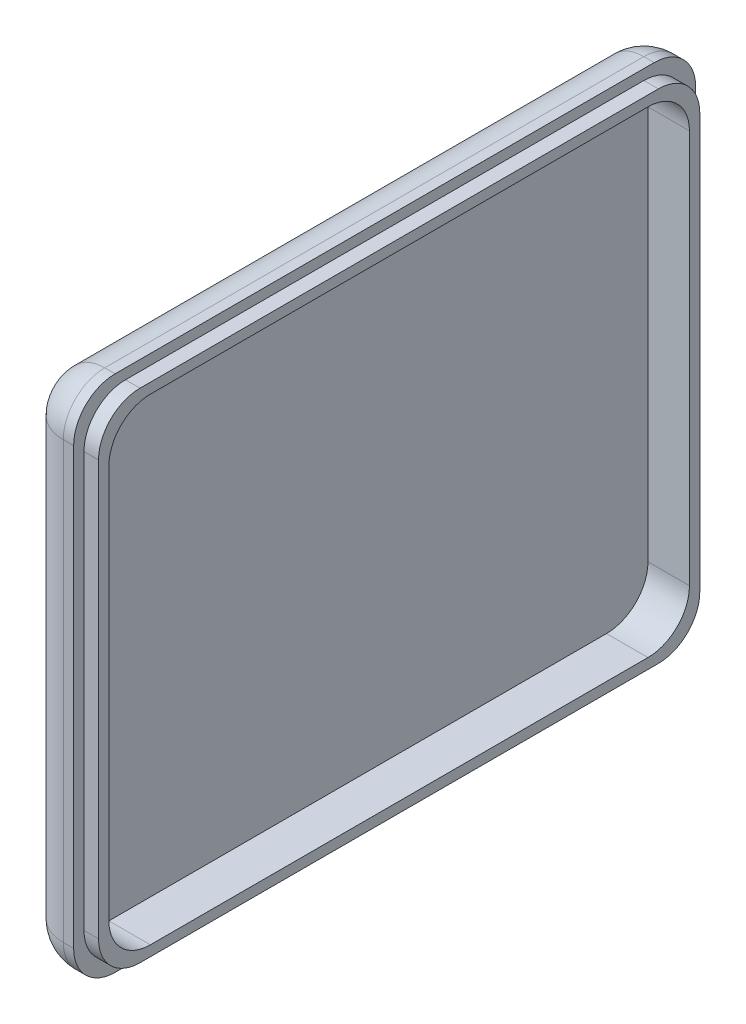
from build123d import *

# Parameters (mm, degrees)
SKETCH5_W           = 76.2
SKETCH5_H           = 63.5
BOSS_EXTRUDE2_DEPTH = 6.35
SKETCH6_W           = 73.66
SKETCH6_H           = 60.96
BOSS_EXTRUDE3_DEPTH = 1.778
SKETCH7_W           = 71.12
SKETCH7_H           = 58.42
CUT_EXTRUDE2_DEPTH  = 5.08
FILLET7_R           = 5.08
FILLET8_R           = 5.08
FILLET9_R           = 5.08
FILLET10_R          = 5.08
FILLET11_R          = 5.08
FILLET12_R          = 5.08
FILLET13_R          = 5.08


with BuildPart() as part:
    # Sketch5 → Boss-Extrude2 (new body)
    with BuildSketch(Plane(origin=(0, 0, 0), x_dir=(0, 0, -1), z_dir=(1, 0, 0))):
        with Locations((65.870666667, 31.75)):
            Rectangle(SKETCH5_W, SKETCH5_H)
    extrude(amount=BOSS_EXTRUDE2_DEPTH)

    # Sketch6 → Boss-Extrude3 (add)
    with BuildSketch(Plane(origin=(6.35, 0, 0), x_dir=(0, 0, -1), z_dir=(1, 0, 0))):
        with Locations((65.870666667, 31.75)):
            Rectangle(SKETCH6_W, SKETCH6_H)
    extrude(amount=BOSS_EXTRUDE3_DEPTH)

    # Sketch7 → Cut-Extrude2 (cut)
    with BuildSketch(Plane(origin=(8.128, 0, 0), x_dir=(0, 0, -1), z_dir=(1, 0, 0))):
        with Locations((65.870666667, 31.75)):
            Rectangle(SKETCH7_W, SKETCH7_H)
    extrude(amount=-CUT_EXTRUDE2_DEPTH, mode=Mode.SUBTRACT)

    # Fillet7
    fillet7_edges = [part.edges().sort_by_distance(p)[0] for p in [
        (5.588, 2.54, -30.310666667),
        (5.588, 2.54, -101.430666667),
    ]]
    fillet(fillet7_edges, radius=FILLET7_R)

    # Fillet8
    fillet8_edges = [part.edges().sort_by_distance(p)[0] for p in [
        (5.588, 60.96, -30.310666667),
        (5.588, 60.96, -101.430666667),
    ]]
    fillet(fillet8_edges, radius=FILLET8_R)

    # Fillet9
    fillet9_edges = [part.edges().sort_by_distance(p)[0] for p in [
        (7.239, 1.27, -29.040666667),
    ]]
    fillet(fillet9_edges, radius=FILLET9_R)

    # Fillet10
    fillet10_edges = [part.edges().sort_by_distance(p)[0] for p in [
        (3.175, 0, -27.770666667),
    ]]
    fillet(fillet10_edges, radius=FILLET10_R)

    # Fillet11
    fillet11_edges = [part.edges().sort_by_distance(p)[0] for p in [
        (7.239, 1.27, -102.700666667),
        (7.239, 62.23, -102.700666667),
        (3.175, 63.5, -103.970666667),
        (3.175, 0, -103.970666667),
    ]]
    fillet(fillet11_edges, radius=FILLET11_R)

    # Fillet12
    fillet12_edges = [part.edges().sort_by_distance(p)[0] for p in [
        (7.239, 62.23, -29.040666667),
        (3.175, 63.5, -27.770666667),
    ]]
    fillet(fillet12_edges, radius=FILLET12_R)

    # Fillet13
    fillet13_edges = [part.edges().sort_by_distance(p)[0] for p in [
        (0, 31.75, -27.770666667),
        (0, 62.012102448, -29.258564218),
        (0, 0, -65.870666667),
        (0, 1.487897552, -29.258564218),
        (0, 63.5, -65.870666667),
        (0, 31.75, -103.970666667),
        (0, 1.487897552, -102.482769115),
        (0, 62.012102448, -102.482769115),
    ]]
    fillet(fillet13_edges, radius=FILLET13_R)


solid = part.part
